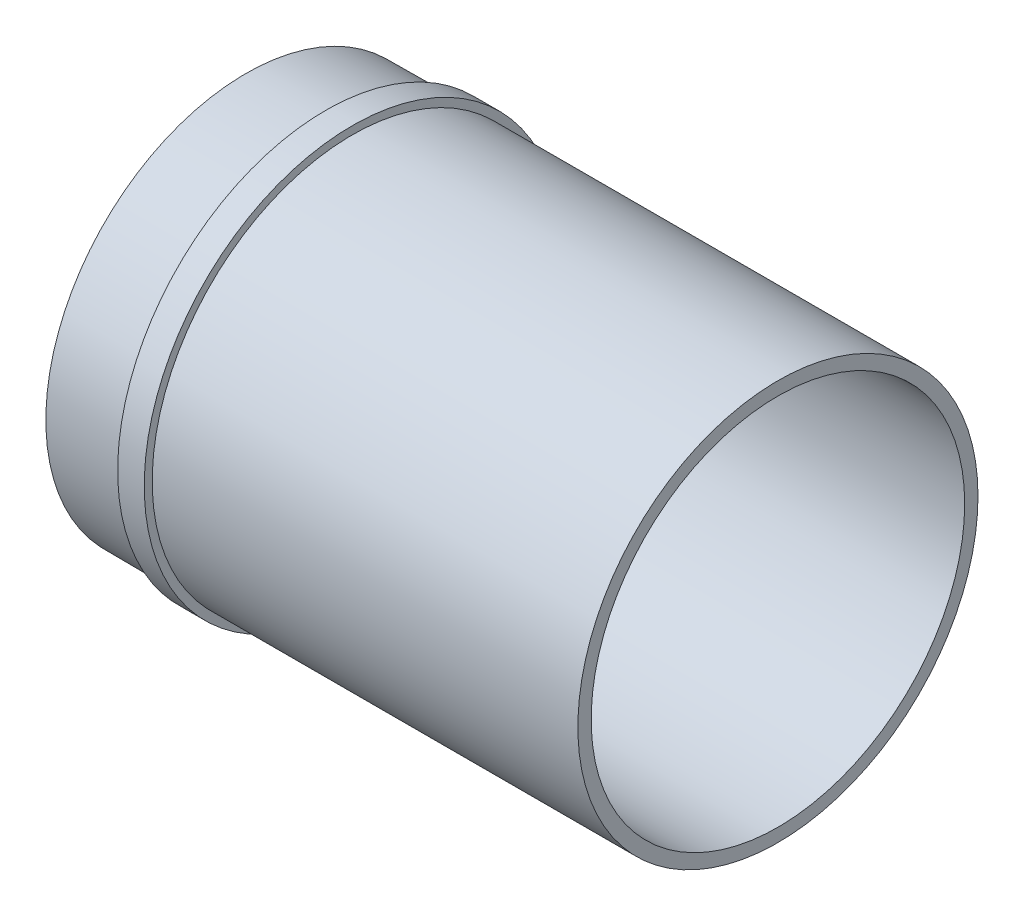
from build123d import *


with BuildPart() as part:
    # Sketch1 → Revolve1 (revolve)
    with BuildSketch(Plane.XY, mode=Mode.PRIVATE) as revolve1_sk:
        with BuildLine():
            Line((0, 3632.5), (0, 3635.5))
            ThreePointArc((0, 3635.5), (-5.000004729, 3635.496561675), (-10, 3635.486246708))
            Line((-10, 3635.486246708), (-10, 3632.986237243))
            Line((-10, 3632.986237243), (-10, 3632.686236107))
            ThreePointArc((-10, 3632.686236107), (-25.000213137, 3632.613973345), (-40, 3632.479771451))
            Line((-40, 3632.479771451), (-40, 3630.279637989))
            ThreePointArc((-40, 3630.279637989), (-22.500261409, 3630.430275909), (-5, 3630.496556946))
            Line((-5, 3630.496556946), (-5, 3627.5))
            Line((-5, 3627.5), (160, 3627.5))
            Line((160, 3627.5), (160, 3632.5))
            Line((160, 3632.5), (0, 3632.5))
        make_face()
        with BuildLine():
            Line((-40, 3627.5), (-5, 3627.5))
            Line((-5, 3627.5), (-5, 3630.496556946))
            ThreePointArc((-5, 3630.496556946), (-22.500261409, 3630.430275909), (-40, 3630.279637989))
            Line((-40, 3630.279637989), (-40, 3627.5))
        make_face()
    revolve(revolve1_sk.sketch.rotate(Axis((0, 3557.296761587, 0), (-1, 0, 0)), 90), axis=Axis((0, 3557.296761587, 0), (-1, 0, 0)))


solid = part.part
